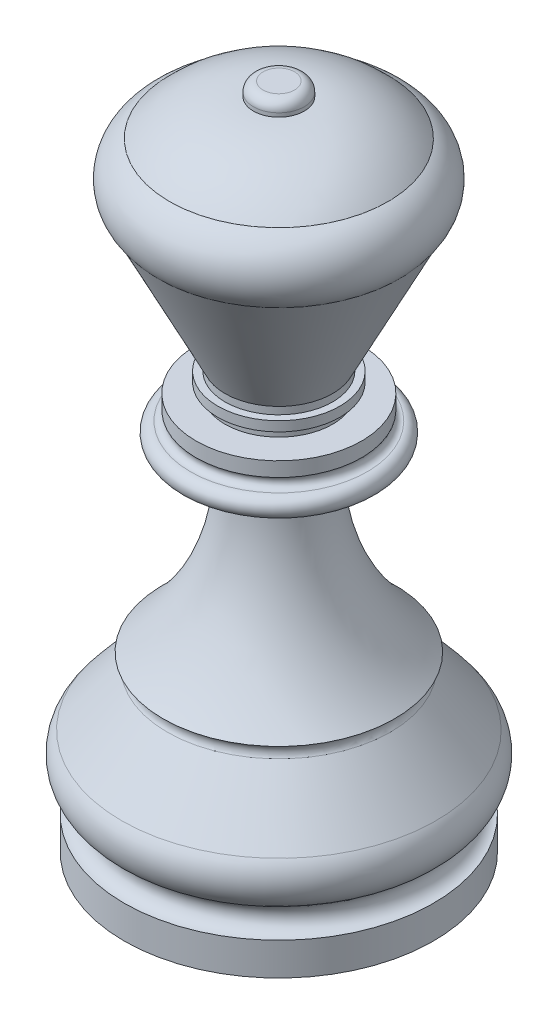
from build123d import *

# Parameters (mm, degrees)
RADYUS1_R = 1


with BuildPart() as part:
    # Çizim1 → Döndür1 (revolve)
    with BuildSketch(Plane.XY, mode=Mode.PRIVATE) as d_nd_r1_sk:
        with BuildLine():
            Line((-8.519437071, -30.941091733), (7.480562929, -30.941091733))
            Line((7.480562929, -30.941091733), (7.480562929, -27.552250754))
            ThreePointArc((7.480562929, -27.552250754), (6.151860071, -26.519014448), (6.824689447, -24.976182902))
            ThreePointArc((6.824689447, -24.976182902), (8.464276563, -22.718623744), (7.749306828, -20.021655532))
            Line((7.749306828, -20.021655532), (3.027449735, -14.447184771))
            ThreePointArc((3.027449735, -14.447184771), (2.874866258, -13.621483114), (3.467494088, -13.02662414))
            ThreePointArc((3.467494088, -13.02662414), (-2.278592527, -4.52455536), (-3.620545274, 5.649030425))
            Line((-3.620545274, 5.649030425), (0.621823835, 5.649030425))
            ThreePointArc((0.621823835, 5.649030425), (1.636853583, 6.664060173), (0.621823835, 7.67908992))
            ThreePointArc((0.621823835, 7.67908992), (0.031499883, 7.984585652), (0.045272234, 8.649130859))
            Line((0.045272234, 8.649130859), (0.045272234, 10.149130859))
            Line((0.045272234, 10.149130859), (-2.954727766, 10.149130859))
            Line((-2.954727766, 10.149130859), (-2.954727766, 11.149130859))
            Line((-2.954727766, 11.149130859), (-2.204727766, 11.149130859))
            Line((-2.204727766, 11.149130859), (-2.204727766, 12.149130859))
            Line((-2.204727766, 12.149130859), (-2.954727766, 12.149130859))
            Line((-2.954727766, 12.149130859), (-2.954727766, 12.899130859))
            Line((-2.954727766, 12.899130859), (3.930085449, 26.609481243))
            ThreePointArc((3.930085449, 26.609481243), (4.983006629, 30.08340271), (2.793013204, 32.978346951))
            ThreePointArc((2.793013204, 32.978346951), (-1.157493434, 35.761136828), (-5.888982883, 36.742681419))
            Line((-5.888982883, 36.742681419), (-5.888982883, 38.134893718))
            Line((-5.888982883, 38.134893718), (-8.519437071, 38.134893718))
            Line((-8.519437071, 38.134893718), (-8.519437071, 35.558908267))
            Line((-8.519437071, 35.558908267), (-8.519437071, -30.941091733))
        make_face()
    revolve(d_nd_r1_sk.sketch.rotate(Axis((-8.519437071, 57.101125378, 0), (0, -1, 0)), 90), axis=Axis((-8.519437071, 57.101125378, 0), (0, -1, 0)))

    # Radyus1
    radyus1_edges = [part.edges().sort_by_distance(p)[0] for p in [
        (-8.519437071, 38.134893718, -2.630454188),
    ]]
    fillet(radyus1_edges, radius=RADYUS1_R)


solid = part.part
